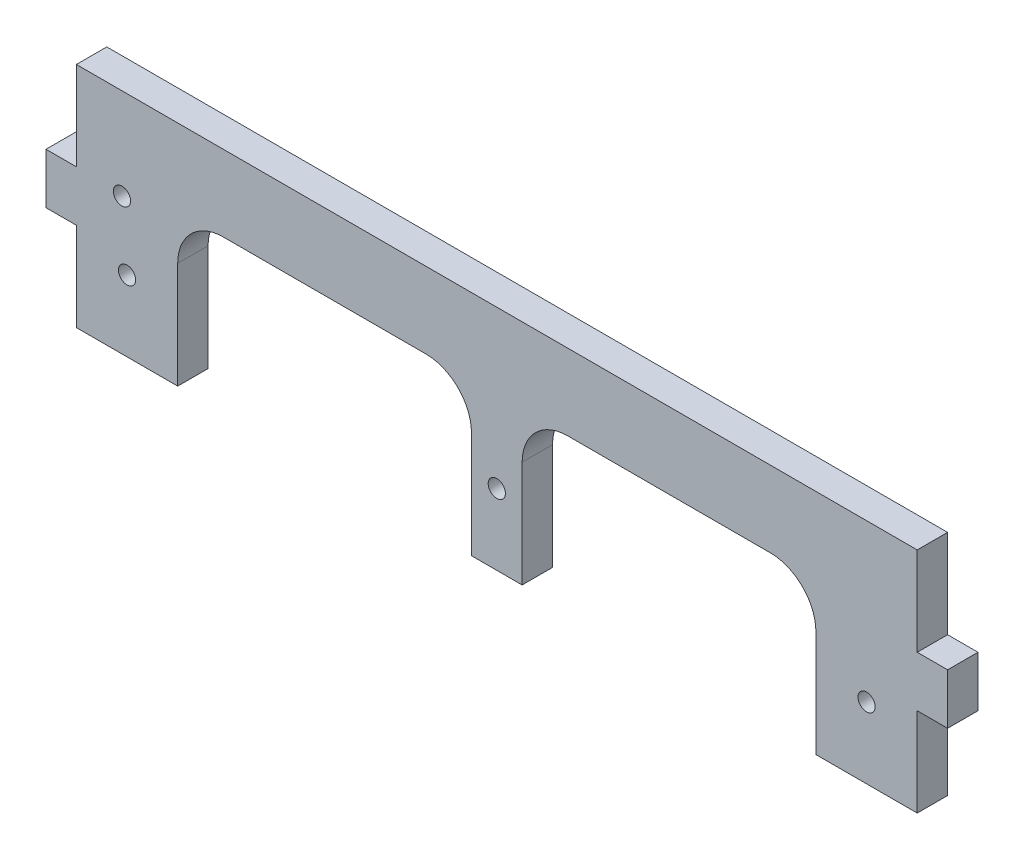
from build123d import *

# Parameters (mm, degrees)
BOSS_EXTRUDE1_DEPTH = 6
FILLET1_R           = 9
SKETCH2_R           = 1.7
CUT_EXTRUDE1_DEPTH  = 178.890415706
SKETCH3_R           = 1.7
CUT_EXTRUDE2_DEPTH  = 178.890415706


with BuildPart() as part:
    # Sketch1 → Boss-Extrude1 (new body)
    with BuildSketch(Plane.XY):
        Polygon((0, 0), (0, 17.5), (-6, 17.5), (-6, 27.5), (0, 27.5), (0, 45), (166, 45), (166, 27.5), (172, 27.5), (172, 17.5), (166, 17.5), (166, 0), (146, 0), (146, 30), (88, 30), (88, 0), (78, 0), (78, 30), (20, 30), (20, 0), align=None)
    extrude(amount=BOSS_EXTRUDE1_DEPTH)

    # Fillet1
    fillet1_edges = [part.edges().sort_by_distance(p)[0] for p in [
        (146, 30, 3),
        (88, 30, 3),
        (78, 30, 3),
        (20, 30, 3),
    ]]
    fillet(fillet1_edges, radius=FILLET1_R)

    # Sketch2 → Cut-Extrude1 (cut, through all)
    with BuildSketch(Plane.XY.offset(6)):
        with Locations((10, 14)):
            Circle(SKETCH2_R)
        with Locations((83, 14)):
            Circle(SKETCH2_R)
        with Locations((156, 14)):
            Circle(SKETCH2_R)
    extrude(amount=-CUT_EXTRUDE1_DEPTH, mode=Mode.SUBTRACT)

    # Sketch3 → Cut-Extrude2 (cut, through all)
    with BuildSketch(Plane.XY.offset(6)):
        with Locations((9, 27)):
            Circle(SKETCH3_R)
    extrude(amount=-CUT_EXTRUDE2_DEPTH, mode=Mode.SUBTRACT)


solid = part.part
